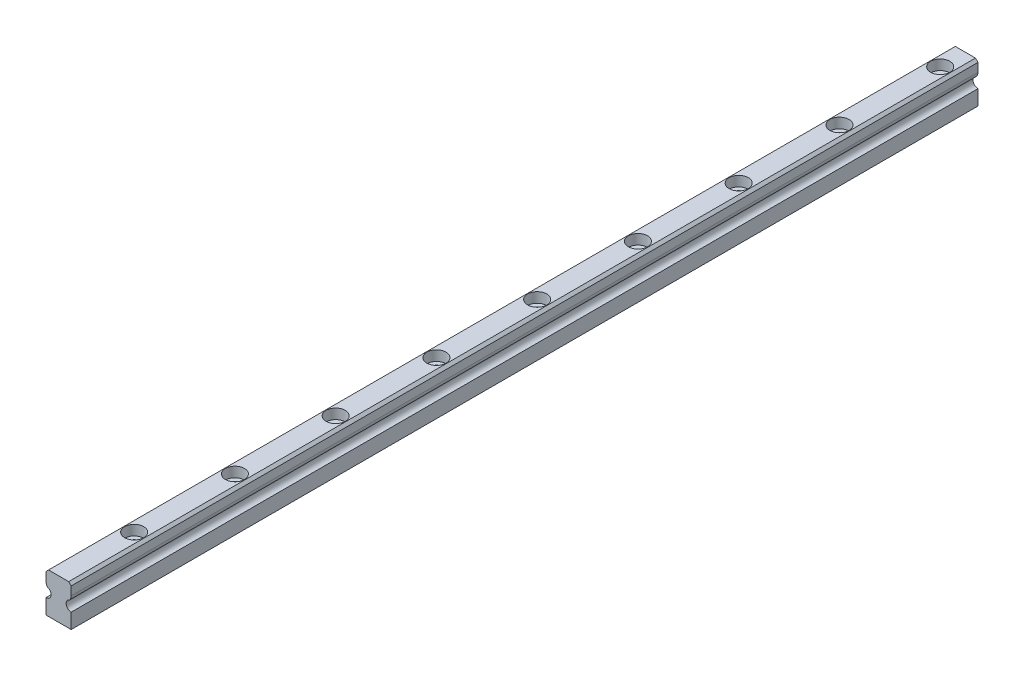
from build123d import *

# Parameters (mm, degrees)
SKETCH1_W           = 5
SKETCH1_H           = 8
BOSS_EXTRUDE1_DEPTH = 185
BOSS_EXTRUDE2_DEPTH = 200
SKETCH3_W           = 5
SKETCH3_H           = 8
CUT_EXTRUDE1_DEPTH  = 200
CUT_EXTRUDE2_REACH  = 202.176
SKETCH4_R           = 1
SKETCH5_R           = 1.9
CUT_EXTRUDE3_DEPTH  = 2
CHAMFER1_SIZE       = 0.5
CHAMFER2_SIZE       = 0.5
CUT_EXTRUDE4_DEPTH  = 5


with BuildPart() as part:
    # Sketch1 → Boss-Extrude1 (new body)
    with BuildSketch(Plane.XY):
        Rectangle(SKETCH1_W, SKETCH1_H)
    extrude(amount=BOSS_EXTRUDE1_DEPTH)

    # Sketch2 → Boss-Extrude2 (add)
    with BuildSketch(Plane(origin=(0, 0, 0), x_dir=(-1, 0, 0), z_dir=(0, 0, -1))):
        with BuildLine():
            Line((-2.5, 4), (-2.5, 1.798202453))
            ThreePointArc((-2.5, 1.798202453), (-2.423157727, 1.350663613), (-2.2014329, 0.954388646))
            ThreePointArc((-2.2014329, 0.954388646), (-1.511468603, -0.151015487), (-2.5, -1))
            Line((-2.5, -1), (-2.5, -4))
            Line((-2.5, -4), (2.5, -4))
            Line((2.5, -4), (2.5, -1))
            ThreePointArc((2.5, -1), (1.511468603, -0.151015487), (2.2014329, 0.954388646))
            ThreePointArc((2.2014329, 0.954388646), (2.423157727, 1.350663613), (2.5, 1.798202453))
            Line((2.5, 1.798202453), (2.5, 4))
            Line((2.5, 4), (-2.5, 4))
        make_face()
    extrude(amount=BOSS_EXTRUDE2_DEPTH)

    # Sketch3 → Cut-Extrude1 (cut)
    with BuildSketch(Plane.XY.offset(185)):
        Rectangle(SKETCH3_W, SKETCH3_H)
    extrude(amount=-CUT_EXTRUDE1_DEPTH, mode=Mode.SUBTRACT)

    # Sketch4 → Cut-Extrude2 (cut, up to next)
    with BuildSketch(Plane.XZ.offset(4), mode=Mode.PRIVATE) as cut_extrude2_sk1:
        with Locations(Location((0, -35, 0), (0, 0, 270))):
            Circle(SKETCH4_R)
    cut_extrude2_tool1 = extrude(cut_extrude2_sk1.sketch, amount=-CUT_EXTRUDE2_REACH, mode=Mode.PRIVATE) & part.part
    # Sketch4 → Cut-Extrude2 (cut, up to next)
    with BuildSketch(Plane.XZ.offset(4), mode=Mode.PRIVATE) as cut_extrude2_sk2:
        with Locations(Location((0, -55, 0), (0, 0, 270))):
            Circle(SKETCH4_R)
    cut_extrude2_tool2 = extrude(cut_extrude2_sk2.sketch, amount=-CUT_EXTRUDE2_REACH, mode=Mode.PRIVATE) & part.part
    # Sketch4 → Cut-Extrude2 (cut, up to next)
    with BuildSketch(Plane.XZ.offset(4), mode=Mode.PRIVATE) as cut_extrude2_sk3:
        with Locations(Location((0, -75, 0), (0, 0, 270))):
            Circle(SKETCH4_R)
    cut_extrude2_tool3 = extrude(cut_extrude2_sk3.sketch, amount=-CUT_EXTRUDE2_REACH, mode=Mode.PRIVATE) & part.part
    # Sketch4 → Cut-Extrude2 (cut, up to next)
    with BuildSketch(Plane.XZ.offset(4), mode=Mode.PRIVATE) as cut_extrude2_sk4:
        with Locations(Location((0, -95, 0), (0, 0, 270))):
            Circle(SKETCH4_R)
    cut_extrude2_tool4 = extrude(cut_extrude2_sk4.sketch, amount=-CUT_EXTRUDE2_REACH, mode=Mode.PRIVATE) & part.part
    # Sketch4 → Cut-Extrude2 (cut, up to next)
    with BuildSketch(Plane.XZ.offset(4), mode=Mode.PRIVATE) as cut_extrude2_sk5:
        with Locations(Location((0, -115, 0), (0, 0, 270))):
            Circle(SKETCH4_R)
    cut_extrude2_tool5 = extrude(cut_extrude2_sk5.sketch, amount=-CUT_EXTRUDE2_REACH, mode=Mode.PRIVATE) & part.part
    # Sketch4 → Cut-Extrude2 (cut, up to next)
    with BuildSketch(Plane.XZ.offset(4), mode=Mode.PRIVATE) as cut_extrude2_sk6:
        with Locations(Location((0, -135, 0), (0, 0, 270))):
            Circle(SKETCH4_R)
    cut_extrude2_tool6 = extrude(cut_extrude2_sk6.sketch, amount=-CUT_EXTRUDE2_REACH, mode=Mode.PRIVATE) & part.part
    # Sketch4 → Cut-Extrude2 (cut, up to next)
    with BuildSketch(Plane.XZ.offset(4), mode=Mode.PRIVATE) as cut_extrude2_sk7:
        with Locations(Location((0, -155, 0), (0, 0, 270))):
            Circle(SKETCH4_R)
    cut_extrude2_tool7 = extrude(cut_extrude2_sk7.sketch, amount=-CUT_EXTRUDE2_REACH, mode=Mode.PRIVATE) & part.part
    # Sketch4 → Cut-Extrude2 (cut, up to next)
    with BuildSketch(Plane.XZ.offset(4), mode=Mode.PRIVATE) as cut_extrude2_sk8:
        with Locations(Location((0, -175, 0), (0, 0, 270))):
            Circle(SKETCH4_R)
    cut_extrude2_tool8 = extrude(cut_extrude2_sk8.sketch, amount=-CUT_EXTRUDE2_REACH, mode=Mode.PRIVATE) & part.part
    # Sketch4 → Cut-Extrude2 (cut, up to next)
    with BuildSketch(Plane.XZ.offset(4), mode=Mode.PRIVATE) as cut_extrude2_sk9:
        with Locations(Location((0, -195, 0), (0, 0, 270))):
            Circle(SKETCH4_R)
    cut_extrude2_tool9 = extrude(cut_extrude2_sk9.sketch, amount=-CUT_EXTRUDE2_REACH, mode=Mode.PRIVATE) & part.part
    add(cut_extrude2_tool1.solids().sort_by_distance((0, -4, -35))[0], mode=Mode.SUBTRACT)
    add(cut_extrude2_tool2.solids().sort_by_distance((0, -4, -55))[0], mode=Mode.SUBTRACT)
    add(cut_extrude2_tool3.solids().sort_by_distance((0, -4, -75))[0], mode=Mode.SUBTRACT)
    add(cut_extrude2_tool4.solids().sort_by_distance((0, -4, -95))[0], mode=Mode.SUBTRACT)
    add(cut_extrude2_tool5.solids().sort_by_distance((0, -4, -115))[0], mode=Mode.SUBTRACT)
    add(cut_extrude2_tool6.solids().sort_by_distance((0, -4, -135))[0], mode=Mode.SUBTRACT)
    add(cut_extrude2_tool7.solids().sort_by_distance((0, -4, -155))[0], mode=Mode.SUBTRACT)
    add(cut_extrude2_tool8.solids().sort_by_distance((0, -4, -175))[0], mode=Mode.SUBTRACT)
    add(cut_extrude2_tool9.solids().sort_by_distance((0, -4, -195))[0], mode=Mode.SUBTRACT)

    # Sketch5 → Cut-Extrude3 (cut)
    with BuildSketch(Plane(origin=(0, 4, 0), x_dir=(1, 0, 0), z_dir=(0, 1, 0))):
        with Locations(Location((0, 195, 0), (0, 0, 180))):
            Circle(SKETCH5_R)
        with Locations(Location((0, 175, 0), (0, 0, 180))):
            Circle(SKETCH5_R)
        with Locations(Location((0, 155, 0), (0, 0, 180))):
            Circle(SKETCH5_R)
        with Locations(Location((0, 135, 0), (0, 0, 180))):
            Circle(SKETCH5_R)
        with Locations(Location((0, 115, 0), (0, 0, 180))):
            Circle(SKETCH5_R)
        with Locations(Location((0, 95, 0), (0, 0, 180))):
            Circle(SKETCH5_R)
        with Locations(Location((0, 75, 0), (0, 0, 180))):
            Circle(SKETCH5_R)
        with Locations(Location((0, 55, 0), (0, 0, 180))):
            Circle(SKETCH5_R)
        with Locations(Location((0, 35, 0), (0, 0, 180))):
            Circle(SKETCH5_R)
    extrude(amount=-CUT_EXTRUDE3_DEPTH, mode=Mode.SUBTRACT)

    # Chamfer1
    chamfer1_edges = [part.edges().sort_by_distance(p)[0] for p in [
        (-2.5, 4, -107.5),
    ]]
    chamfer(chamfer1_edges, length=CHAMFER1_SIZE)

    # Chamfer2
    chamfer2_edges = [part.edges().sort_by_distance(p)[0] for p in [
        (2.5, 4, -107.5),
    ]]
    chamfer(chamfer2_edges, length=CHAMFER2_SIZE)

    # Sketch6 → Cut-Extrude4 (cut)
    with BuildSketch(Plane.XY.offset(-15)):
        with BuildLine():
            Line((2.5, 1.798202453), (2.5, 3.5))
            Line((2.5, 3.5), (2, 4))
            Line((2, 4), (-2, 4))
            Line((-2, 4), (-2.5, 3.5))
            Line((-2.5, 3.5), (-2.5, 1.798202453))
            ThreePointArc((-2.5, 1.798202453), (-2.423157727, 1.350663613), (-2.2014329, 0.954388646))
            ThreePointArc((-2.2014329, 0.954388646), (-1.511468603, -0.151015487), (-2.5, -1))
            Line((-2.5, -1), (-2.5, -4))
            Line((-2.5, -4), (2.5, -4))
            Line((2.5, -4), (2.5, -1))
            ThreePointArc((2.5, -1), (1.511468603, -0.151015487), (2.2014329, 0.954388646))
            ThreePointArc((2.2014329, 0.954388646), (2.423157727, 1.350663613), (2.5, 1.798202453))
        make_face()
    extrude(amount=-CUT_EXTRUDE4_DEPTH, mode=Mode.SUBTRACT)


solid = part.part
